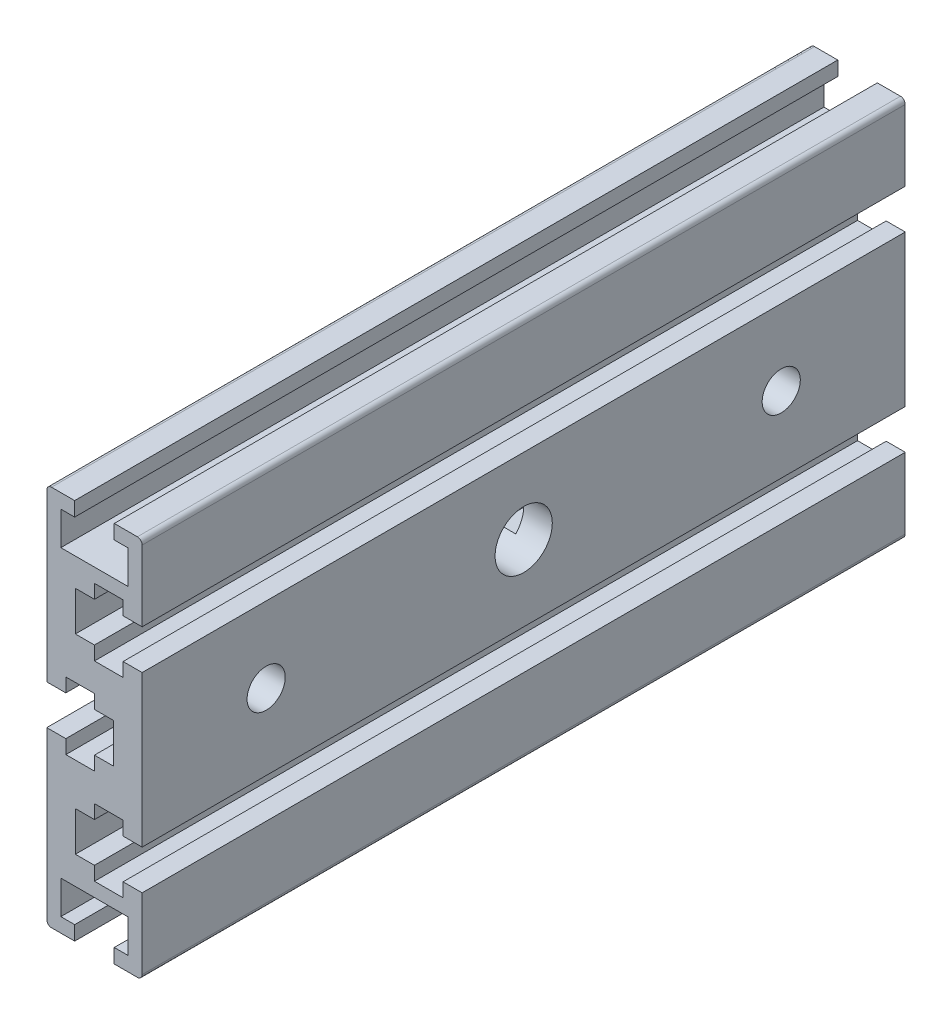
from build123d import *

# Parameters (mm, degrees)
EXTRUDE_1_DEPTH           = 160
HOLE_WIZARD_8_0_8_1_D     = 8
HOLE_WIZARD_8_0_8_2_D     = 8
HOLE_WIZARD_8_0_8_2_DEPTH = 8
HOLE_WIZARD_8_0_8_2_TIP   = 2.403442476
HOLE_WIZARD_12_0_12_2_D   = 12
HOLE_WIZARD_5_5_5_5_1_D   = 5.5
HOLE_WIZARD_5_5_5_5_2_D   = 5.5
HOLE_WIZARD_5_5_5_5_3_D   = 5.5
HOLE_WIZARD_5_5_5_5_4_D   = 5.5
HOLE_WIZARD_M5_1_D        = 4.2
HOLE_WIZARD_M5_2_D        = 4.2


with BuildPart() as part:
    # Sketch1 → 凸台-拉伸1 (new body)
    with BuildSketch(Plane.XY):
        with BuildLine():
            Line((-9, 40), (-4.15, 40))
            Line((-4.15, 40), (-4.15, 37))
            Line((-4.15, 37), (-7.05, 37))
            Line((-7.05, 37), (-7.05, 30))
            Line((-7.05, 30), (7.05, 30))
            Line((7.05, 30), (7.05, 37))
            Line((7.05, 37), (4.15, 37))
            Line((4.15, 37), (4.15, 40))
            Line((4.15, 40), (9, 40))
            ThreePointArc((9, 40), (9.707106781, 39.707106781), (10, 39))
            Line((10, 39), (10, 24.15))
            Line((10, 24.15), (6, 24.15))
            Line((6, 24.15), (6, 27.05))
            Line((6, 27.05), (0, 27.05))
            Line((0, 27.05), (0, 24.15))
            Line((0, 24.15), (-4, 24.15))
            Line((-4, 24.15), (-4, 15.85))
            Line((-4, 15.85), (0, 15.85))
            Line((0, 15.85), (0, 12.95))
            Line((0, 12.95), (6, 12.95))
            Line((6, 12.95), (6, 15.85))
            Line((6, 15.85), (10, 15.85))
            Line((10, 15.85), (10, -15.85))
            Line((10, -15.85), (6, -15.85))
            Line((6, -15.85), (6, -12.95))
            Line((6, -12.95), (0, -12.95))
            Line((0, -12.95), (0, -15.85))
            Line((0, -15.85), (-4, -15.85))
            Line((-4, -15.85), (-4, -24.15))
            Line((-4, -24.15), (0, -24.15))
            Line((0, -24.15), (0, -27.05))
            Line((0, -27.05), (6, -27.05))
            Line((6, -27.05), (6, -24.15))
            Line((6, -24.15), (10, -24.15))
            Line((10, -24.15), (10, -39))
            ThreePointArc((10, -39), (9.707106781, -39.707106781), (9, -40))
            Line((9, -40), (4.15, -40))
            Line((4.15, -40), (4.15, -37))
            Line((4.15, -37), (7.05, -37))
            Line((7.05, -37), (7.05, -30))
            Line((7.05, -30), (-7.05, -30))
            Line((-7.05, -30), (-7.05, -37))
            Line((-7.05, -37), (-4.15, -37))
            Line((-4.15, -37), (-4.15, -40))
            Line((-4.15, -40), (-9, -40))
            ThreePointArc((-9, -40), (-9.707106781, -39.707106781), (-10, -39))
            Line((-10, -39), (-10, -4.15))
            Line((-10, -4.15), (-6, -4.15))
            Line((-6, -4.15), (-6, -7.05))
            Line((-6, -7.05), (0, -7.05))
            Line((0, -7.05), (0, -4.15))
            Line((0, -4.15), (4, -4.15))
            Line((4, -4.15), (4, 4.15))
            Line((4, 4.15), (0, 4.15))
            Line((0, 4.15), (0, 7.05))
            Line((0, 7.05), (-6, 7.05))
            Line((-6, 7.05), (-6, 4.15))
            Line((-6, 4.15), (-10, 4.15))
            Line((-10, 4.15), (-10, 39))
            ThreePointArc((-10, 39), (-9.707106781, 39.707106781), (-9, 40))
        make_face()
    extrude(amount=EXTRUDE_1_DEPTH)

    # Ø8.0 (8) 直径孔1 (through all)
    with Locations(Plane(origin=(10, 0, 0), x_dir=(0, 0, -1), z_dir=(1, 0, 0))):
        with Locations((-134, 0)):
            Hole(HOLE_WIZARD_8_0_8_1_D / 2)

    # Ø8.0 (8) 直径孔2
    with Locations(Plane(origin=(10, 0, 0), x_dir=(0, 0, -1), z_dir=(1, 0, 0))):
        with Locations((-26, 0)):
            Hole(HOLE_WIZARD_8_0_8_2_D / 2, depth=HOLE_WIZARD_8_0_8_2_DEPTH)
            with Locations((0, 0, -(HOLE_WIZARD_8_0_8_2_DEPTH + HOLE_WIZARD_8_0_8_2_TIP / 2))):  # 118° drill point
                Cone(0, HOLE_WIZARD_8_0_8_2_D / 2, HOLE_WIZARD_8_0_8_2_TIP, mode=Mode.SUBTRACT)

    # Ø12.0 (12) 直径孔2 (through all)
    with Locations(Plane(origin=(10, 0, 0), x_dir=(0, 0, -1), z_dir=(1, 0, 0))):
        with Locations((-80, 0)):
            Hole(HOLE_WIZARD_12_0_12_2_D / 2)

    # Ø5.5 (5.5) 直径孔1 (through all)
    with Locations(Plane.ZY.offset(10)):
        with Locations((103.6, -20)):
            Hole(HOLE_WIZARD_5_5_5_5_1_D / 2)

    # Ø5.5 (5.5) 直径孔2 (through all)
    with Locations(Plane.ZY.offset(10)):
        with Locations((56.4, -20)):
            Hole(HOLE_WIZARD_5_5_5_5_2_D / 2)

    # Ø5.5 (5.5) 直径孔3 (through all)
    with Locations(Plane.ZY.offset(10)):
        with Locations((103.6, 20)):
            Hole(HOLE_WIZARD_5_5_5_5_3_D / 2)

    # Ø5.5 (5.5) 直径孔4 (through all)
    with Locations(Plane.ZY.offset(10)):
        with Locations((56.4, 20)):
            Hole(HOLE_WIZARD_5_5_5_5_4_D / 2)

    # M5 螺纹孔1 (through all)
    with Locations(Plane.ZY.offset(10)):
        with Locations((80, -18.25)):
            Hole(HOLE_WIZARD_M5_1_D / 2)

    # M5 螺纹孔2 (through all)
    with Locations(Plane.ZY.offset(10)):
        with Locations((80, 18.25)):
            Hole(HOLE_WIZARD_M5_2_D / 2)


solid = part.part
